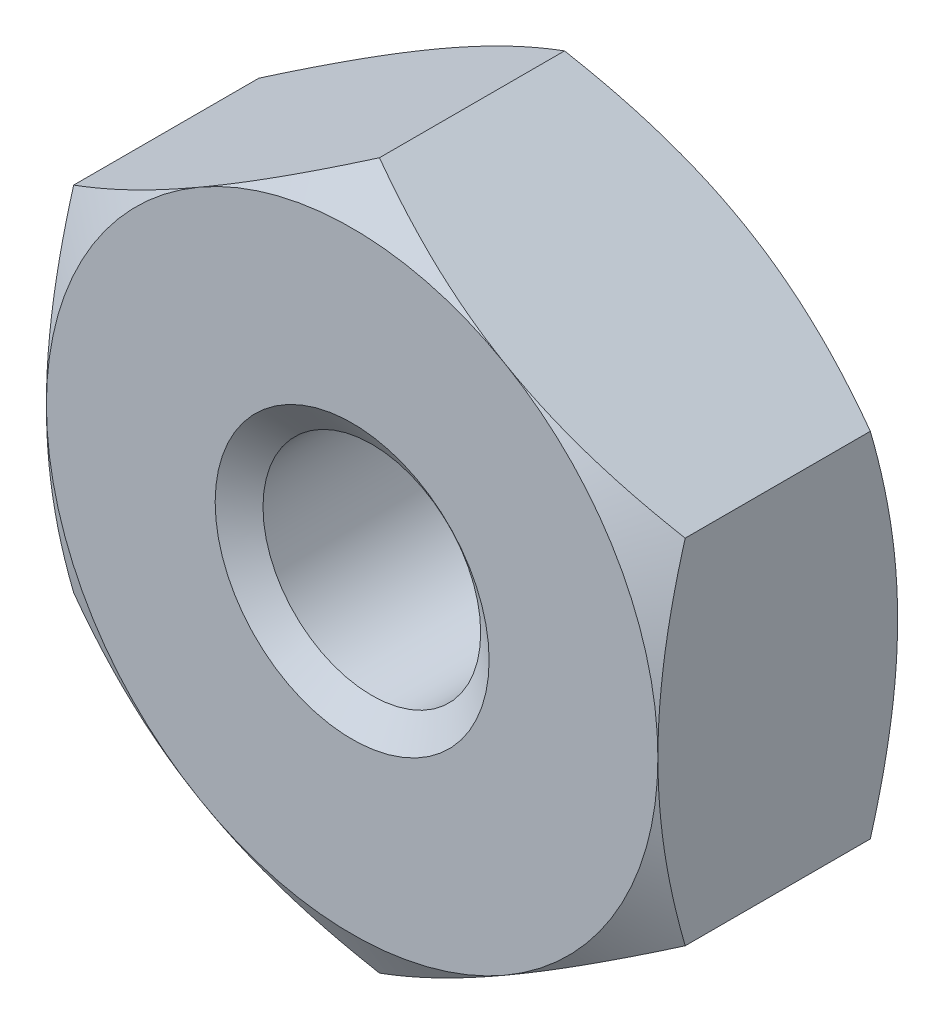
from build123d import *

# Parameters (mm, degrees)
BASENUTSKE_R  = 1.1303
BASENUT_DEPTH = 2.4892


with BuildPart() as part:
    # BaseNutSke → BaseNut (new body)
    with BuildSketch(Plane.XY):
        Polygon((3.175, 1.833087105), (3.175, -1.833087105), (0, -3.666174209), (-3.175, -1.833087105), (-3.175, 1.833087105), (0, 3.666174209), align=None)
        Circle(BASENUTSKE_R, mode=Mode.SUBTRACT)
    extrude(amount=-BASENUT_DEPTH)

    # Sketch3 → Double-Chamfer (revolve, cut)
    with BuildSketch(Plane(origin=(0, 0, 0), x_dir=(0, 0, -1), z_dir=(1, 0, 0))):
        Polygon((2.4892, 3.175), (2.205620438, 3.666174209), (2.205620438, 16.366174209), (15.1892, 16.366174209), (15.1892, 3.175), align=None)
        Polygon((0.283579562, 16.366174209), (-12.7, 16.366174209), (-12.7, 3.175), (0, 3.175), (0.283579562, 3.666174209), align=None)
    revolve(axis=Axis((0, 0, 0), (0, 0, -1)), mode=Mode.SUBTRACT)

    # EndChamferSketch → EndChamfer (revolve, cut)
    with BuildSketch(Plane(origin=(0, 0, 0), x_dir=(0, 0, -1), z_dir=(1, 0, 0)), mode=Mode.PRIVATE) as endchamfer_sk:
        Polygon((2.4638, 1.4224), (2.238816316, 1.10109), (2.5146, 1.10109), (2.5146, 1.4224), align=None)
        Polygon((-0.0508, 1.4224), (0, 1.4224), (0.224983684, 1.10109), (-0.0508, 1.10109), align=None)
    revolve(endchamfer_sk.sketch.rotate(Axis((0, 0, -25.037505729), (0, 0, -1)), 90), axis=Axis((0, 0, -25.037505729), (0, 0, -1)), mode=Mode.SUBTRACT)


solid = part.part
